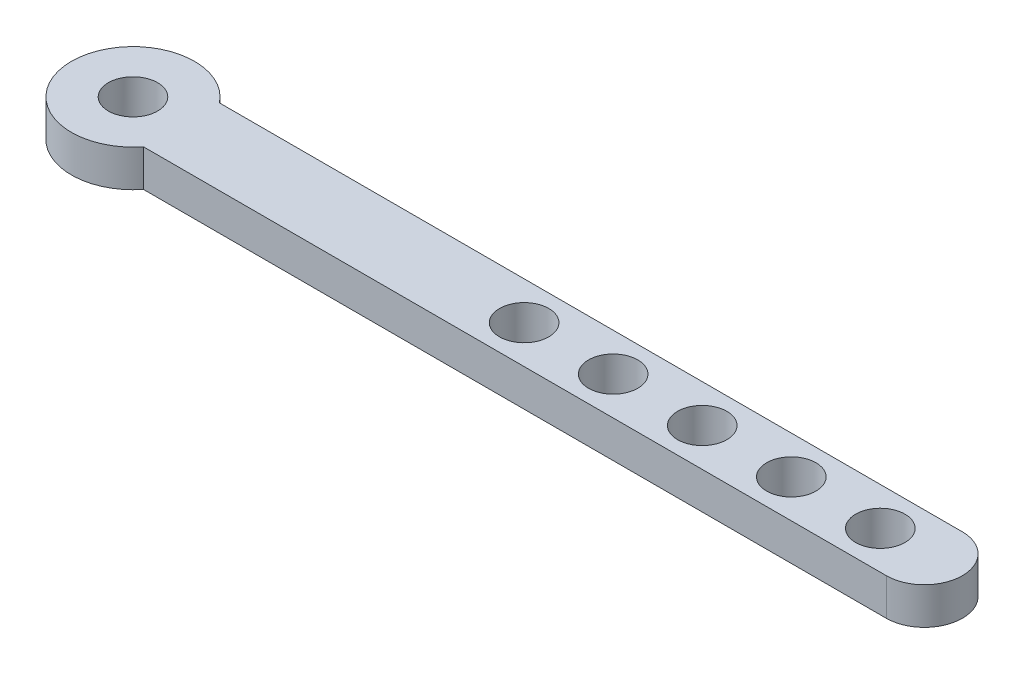
from build123d import *

# Parameters (mm, degrees)
SKETCH2_R           = 2
BOSS_EXTRUDE2_DEPTH = 3
SKETCH6_R           = 5
BOSS_EXTRUDE5_DEPTH = 3
SKETCH8_R           = 2
CUT_EXTRUDE3_DEPTH  = 10


with BuildPart() as part:
    # Sketch2 → Boss-Extrude2 (new body)
    with BuildSketch(Plane(origin=(0, 0, 0), x_dir=(1, 0, 0), z_dir=(0, 1, 0))):
        with BuildLine():
            Line((-32.1334036, 3.086573492), (32.1334036, 3.086573492))
            ThreePointArc((32.1334036, 3.086573492), (35.219977092, 0), (32.1334036, -3.086573492))
            Line((32.1334036, -3.086573492), (-32.1334036, -3.086573492))
            Line((-32.1334036, -3.086573492), (-32.1334036, 3.086573492))
        make_face()
        with Locations(Location((28.558761332, 0, 0), (0, 0, 270))):
            Circle(SKETCH2_R, mode=Mode.SUBTRACT)
        with Locations(Location((21.326683463, 0, 0), (0, 0, 270))):
            Circle(SKETCH2_R, mode=Mode.SUBTRACT)
        with Locations(Location((14.094605594, 0, 0), (0, 0, 270))):
            Circle(SKETCH2_R, mode=Mode.SUBTRACT)
        with Locations(Location((6.862527725, 0, 0), (0, 0, 270))):
            Circle(SKETCH2_R, mode=Mode.SUBTRACT)
        with Locations(Location((-0.369550144, 0, 0), (0, 0, 270))):
            Circle(SKETCH2_R, mode=Mode.SUBTRACT)
    extrude(amount=BOSS_EXTRUDE2_DEPTH)

    # Sketch6 → Boss-Extrude5 (add)
    with BuildSketch(Plane(origin=(0, 3, 0), x_dir=(1, 0, 0), z_dir=(0, 1, 0))):
        with Locations((-32.1334036, 0)):
            Circle(SKETCH6_R)
    extrude(amount=-BOSS_EXTRUDE5_DEPTH)

    # Sketch8 → Cut-Extrude3 (cut)
    with BuildSketch(Plane(origin=(0, 3, 0), x_dir=(1, 0, 0), z_dir=(0, 1, 0))):
        with Locations(Location((-32.1334036, 0, 0), (0, 0, 270))):
            Circle(SKETCH8_R)
    extrude(amount=-CUT_EXTRUDE3_DEPTH, mode=Mode.SUBTRACT)


solid = part.part
